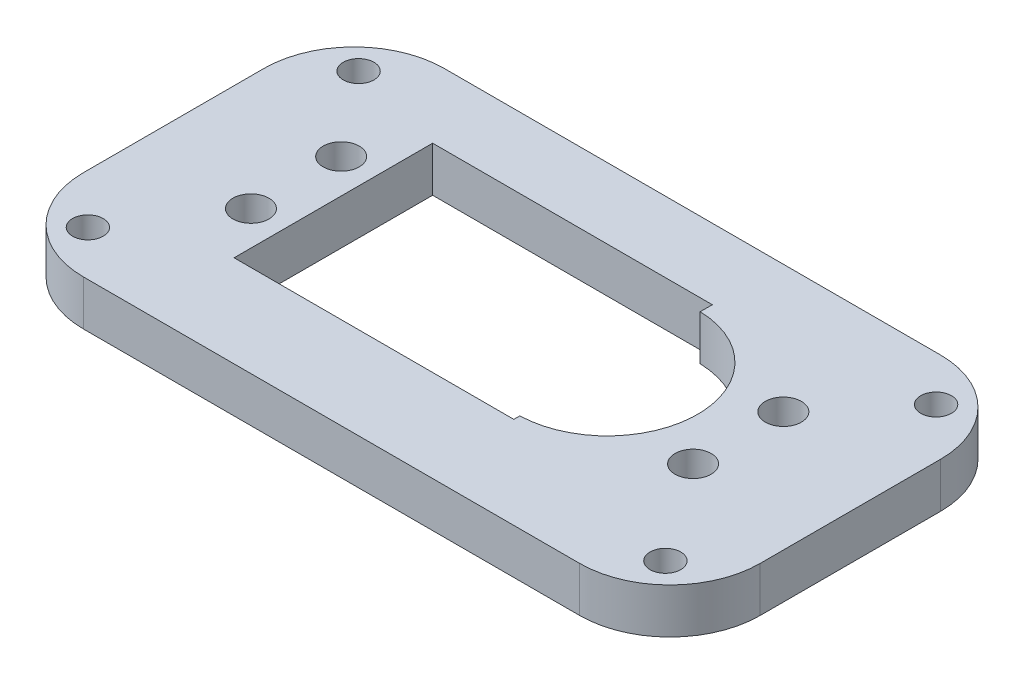
from build123d import *

# Parameters (mm, degrees)
SKETCH9_W           = 75
SKETCH9_H           = 40
BOSS_EXTRUDE5_DEPTH = 5
SKETCH10_R          = 10
SKETCH10_R_2        = 8
SKETCH10_R_3        = 2
CUT_EXTRUDE5_DEPTH  = 43.793106922
SKETCH11_R          = 1.7
CUT_EXTRUDE6_DEPTH  = 43.793106922
FILLET1_R           = 10


with BuildPart() as part:
    # Sketch9 → Boss-Extrude5 (new body)
    with BuildSketch(Plane(origin=(0, 0, 0), x_dir=(1, 0, 0), z_dir=(0, 1, 0))):
        Rectangle(SKETCH9_W, SKETCH9_H)
    extrude(amount=BOSS_EXTRUDE5_DEPTH)

    # Sketch10 → Cut-Extrude5 (cut, through all)
    # profile 1 of 12: a face of its own
    with BuildSketch(Plane(origin=(0, 5, 0), x_dir=(1, 0, 0), z_dir=(0, 1, 0))):
        with Locations((9.729894245, 0.839124812)):
            Circle(SKETCH10_R)
    # profile 2 of 12: a face of its own
    with BuildSketch(Plane(origin=(0, 5, 0), x_dir=(1, 0, 0), z_dir=(0, 1, 0))):
        Polygon((10.022213237, -9.821914184), (10.022213237, 12.178085816), (-20.977786763, 12.184810323), (-20.9811162, -9.817222635), align=None)
        with Locations((-3.270105755, 0.839124812)):
            Circle(SKETCH10_R_2, mode=Mode.SUBTRACT)
    # profile 3 of 12: a face of its own
    with BuildSketch(Plane(origin=(0, 5, 0), x_dir=(1, 0, 0), z_dir=(0, 1, 0))):
        with BuildLine():
            ThreePointArc((19.729894245, 0.839124812), (16.903567987, 7.806075726), (10.022213237, 10.834851379))
            Line((10.022213237, 10.834851379), (10.022213237, -9.156601756))
            ThreePointArc((10.022213237, -9.156601756), (16.903567987, -6.127826103), (19.729894245, 0.839124812))
        make_face()
    # profile 4 of 12: a face of its own
    with BuildSketch(Plane(origin=(0, 5, 0), x_dir=(1, 0, 0), z_dir=(0, 1, 0))):
        with BuildLine():
            Line((10.022213237, -9.156601756), (10.022213237, 10.834851379))
            ThreePointArc((10.022213237, 10.834851379), (5.474717618, 9.888626006), (1.845278861, 6.989965424))
            ThreePointArc((1.845278861, 6.989965424), (3.972928034, 4.235955914), (4.729894245, 0.839124812))
            ThreePointArc((4.729894245, 0.839124812), (3.972928034, -2.557706291), (1.845278861, -5.311715801))
            ThreePointArc((1.845278861, -5.311715801), (5.474717618, -8.210376383), (10.022213237, -9.156601756))
        make_face()
    # profile 5 of 12: a face of its own
    with BuildSketch(Plane(origin=(0, 5, 0), x_dir=(1, 0, 0), z_dir=(0, 1, 0))):
        with Locations((9.729894245, 0.839124812)):
            Circle(SKETCH10_R)
    # profile 6 of 12: a face of its own
    with BuildSketch(Plane(origin=(0, 5, 0), x_dir=(1, 0, 0), z_dir=(0, 1, 0))):
        with Locations((-3.270105755, 0.839124812)):
            Circle(SKETCH10_R_2)
    # profile 7 of 12: a face of its own
    with BuildSketch(Plane(origin=(0, 5, 0), x_dir=(1, 0, 0), z_dir=(0, 1, 0))):
        with Locations((9.729894245, 0.839124812)):
            Circle(SKETCH10_R)
    # profile 8 of 12: a face of its own
    with BuildSketch(Plane(origin=(0, 5, 0), x_dir=(1, 0, 0), z_dir=(0, 1, 0))):
        with Locations((-3.270105755, 0.839124812)):
            Circle(SKETCH10_R_2)
    # profile 9 of 12: a face of its own
    with BuildSketch(Plane(origin=(0, 5, 0), x_dir=(1, 0, 0), z_dir=(0, 1, 0))):
        with Locations(Location((24.229894245, 5.839124812, 0), (0, 0, 270))):
            Circle(SKETCH10_R_3)
    # profile 10 of 12: a face of its own
    with BuildSketch(Plane(origin=(0, 5, 0), x_dir=(1, 0, 0), z_dir=(0, 1, 0))):
        with Locations(Location((24.229894245, -4.160875188, 0), (0, 0, 270))):
            Circle(SKETCH10_R_3)
    # profile 11 of 12: a face of its own
    with BuildSketch(Plane(origin=(0, 5, 0), x_dir=(1, 0, 0), z_dir=(0, 1, 0))):
        with Locations(Location((-24.770105755, 5.839124812, 0), (0, 0, 270))):
            Circle(SKETCH10_R_3)
    # profile 12 of 12: a face of its own
    with BuildSketch(Plane(origin=(0, 5, 0), x_dir=(1, 0, 0), z_dir=(0, 1, 0))):
        with Locations(Location((-24.770105755, -4.160875188, 0), (0, 0, 270))):
            Circle(SKETCH10_R_3)
    extrude(amount=-CUT_EXTRUDE5_DEPTH, mode=Mode.SUBTRACT)

    # Sketch11 → Cut-Extrude6 (cut, through all)
    with BuildSketch(Plane(origin=(0, 5, 0), x_dir=(1, 0, 0), z_dir=(0, 1, 0))):
        with Locations(Location((-32, 15, 0), (0, 0, 270))):
            Circle(SKETCH11_R)
        with Locations(Location((32, 15, 0), (0, 0, 270))):
            Circle(SKETCH11_R)
        with Locations(Location((32, -15, 0), (0, 0, 270))):
            Circle(SKETCH11_R)
        with Locations(Location((-32, -15, 0), (0, 0, 270))):
            Circle(SKETCH11_R)
    extrude(amount=-CUT_EXTRUDE6_DEPTH, mode=Mode.SUBTRACT)

    # Fillet1
    fillet1_edges = [part.edges().sort_by_distance(p)[0] for p in [
        (37.5, 2.5, 20),
        (-37.5, 2.5, 20),
        (-37.5, 2.5, -20),
        (37.5, 2.5, -20),
    ]]
    fillet(fillet1_edges, radius=FILLET1_R)


solid = part.part
